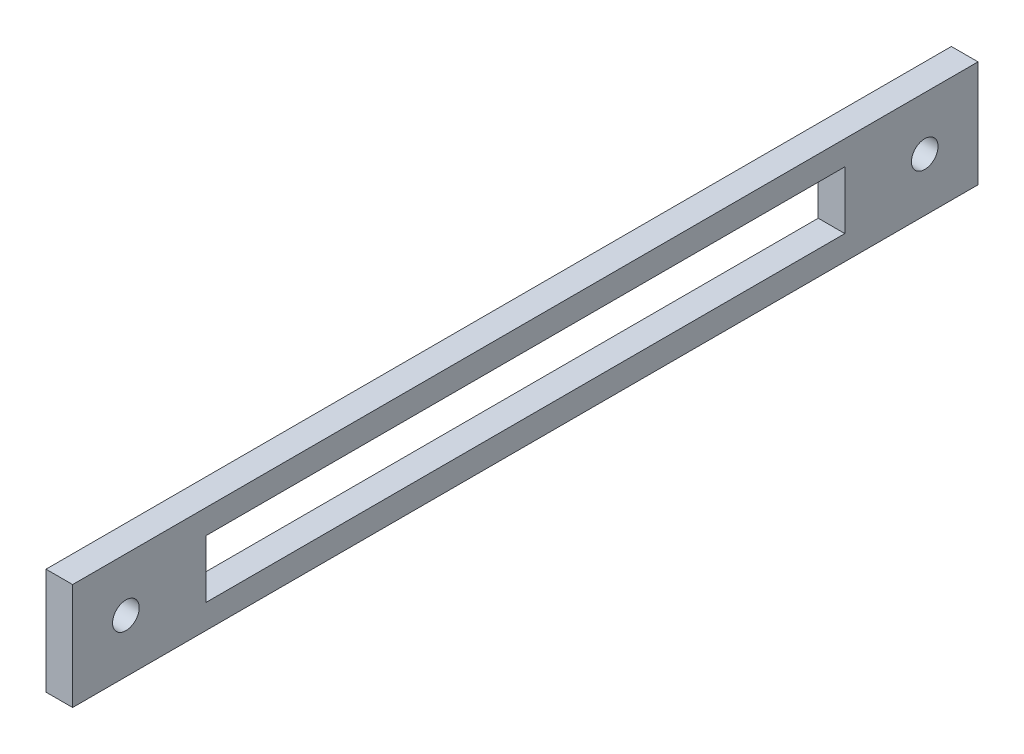
from build123d import *

# Parameters (mm, degrees)
SKETCH_1_W      = 340
SKETCH_1_H      = 40
SKETCH_1_R      = 5
SKETCH_1_W_2    = 240
SKETCH_1_H_2    = 21.717235764
EXTRUDE_1_DEPTH = 10


with BuildPart() as part:
    # 草图1 → 凸台-拉伸1 (new body)
    with BuildSketch(Plane(origin=(0, 0, 0), x_dir=(0, 0, -1), z_dir=(1, 0, 0))):
        Rectangle(SKETCH_1_W, SKETCH_1_H)
        with Locations((-150, 0)):
            Circle(SKETCH_1_R, mode=Mode.SUBTRACT)
        with Locations((150, 0)):
            Circle(SKETCH_1_R, mode=Mode.SUBTRACT)
        Rectangle(SKETCH_1_W_2, SKETCH_1_H_2, mode=Mode.SUBTRACT)
    extrude(amount=EXTRUDE_1_DEPTH)


solid = part.part
